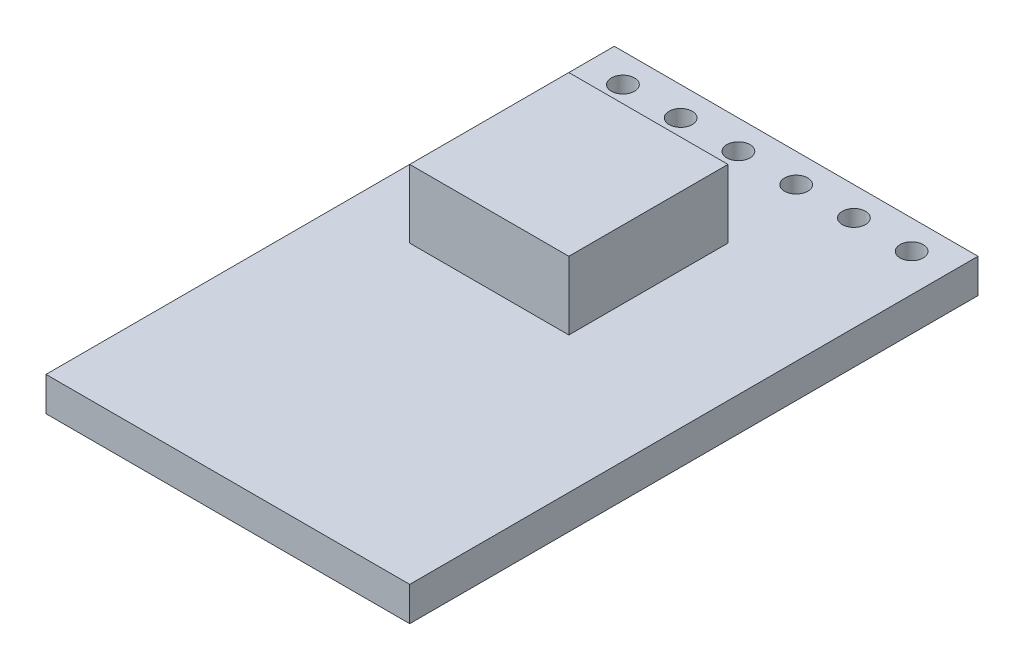
from build123d import *

# Parameters (mm, degrees)
SCHIZZO1_W                   = 16
SCHIZZO1_H                   = 25
ESTRUSIONE_ESTRUSIONE1_DEPTH = 1.5
SCHIZZO2_R                   = 0.51
TAGLIO_ESTRUSIONE1_DEPTH     = 1.5
SCHIZZO3_W                   = 7
SCHIZZO3_H                   = 7
ESTRUSIONE_ESTRUSIONE2_DEPTH = 3


with BuildPart() as part:
    # Schizzo1 → Estrusione-Estrusione1 (new body)
    with BuildSketch(Plane(origin=(0, 0, 0), x_dir=(1, 0, 0), z_dir=(0, 1, 0))):
        with Locations((-8, 12.5)):
            Rectangle(SCHIZZO1_W, SCHIZZO1_H)
    extrude(amount=ESTRUSIONE_ESTRUSIONE1_DEPTH)

    # Schizzo2 → Taglio-Estrusione1 (cut)
    with BuildSketch(Plane(origin=(0, 1.5, 0), x_dir=(1, 0, 0), z_dir=(0, 1, 0))):
        with Locations(Location((-14.35, 23.73, 0), (0, 0, 270))):
            Circle(SCHIZZO2_R)
        with Locations(Location((-11.81, 23.73, 0), (0, 0, 270))):
            Circle(SCHIZZO2_R)
        with Locations(Location((-9.27, 23.73, 0), (0, 0, 270))):
            Circle(SCHIZZO2_R)
        with Locations(Location((-6.73, 23.73, 0), (0, 0, 270))):
            Circle(SCHIZZO2_R)
        with Locations(Location((-4.19, 23.73, 0), (0, 0, 270))):
            Circle(SCHIZZO2_R)
        with Locations(Location((-1.65, 23.73, 0), (0, 0, 270))):
            Circle(SCHIZZO2_R)
    extrude(amount=-TAGLIO_ESTRUSIONE1_DEPTH, mode=Mode.SUBTRACT)

    # Schizzo3 → Estrusione-Estrusione2 (add)
    with BuildSketch(Plane(origin=(0, 1.5, 0), x_dir=(1, 0, 0), z_dir=(0, 1, 0))):
        with Locations((-9.5, 16.5)):
            Rectangle(SCHIZZO3_W, SCHIZZO3_H)
    extrude(amount=ESTRUSIONE_ESTRUSIONE2_DEPTH)


solid = part.part
